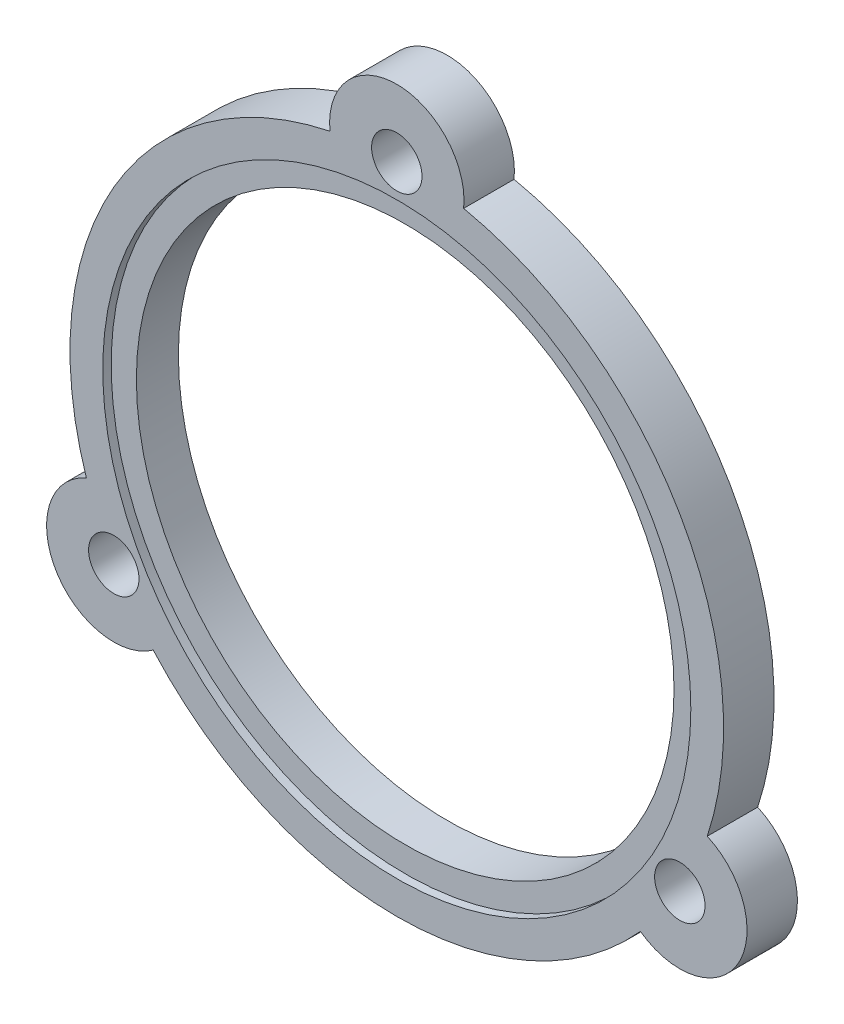
from build123d import *

# Parameters (mm, degrees)
ESQUISSE1_R                                = 19.45
ESQUISSE1_R_2                              = 16
BOSS_EXTRU_1_DEPTH                         = 3
ENL_V_MAT_EXTRU_1_DEPTH                    = 3
BOSS_EXTRU_2_DEPTH                         = 3
R_P_TITION_CIRCULAIRE1_COUNT               = 2
R_P_TITION_CIRCULAIRE1_ANGLE               = 120
R_P_TITION_CIRCULAIRE1_THE_OTHER_WAY_COUNT = 2
R_P_TITION_CIRCULAIRE1_THE_OTHER_WAY_ANGLE = 120
ESQUISSE2_R                                = 17.5
ENL_V_MAT_EXTRU_2_DEPTH                    = 0.5


with BuildPart() as part:
    # Esquisse1 → Boss.-Extru.1 (new body)
    with BuildSketch(Plane.XY):
        Circle(ESQUISSE1_R)
        Circle(ESQUISSE1_R_2, mode=Mode.SUBTRACT)
    extrude(amount=BOSS_EXTRU_1_DEPTH)

    # Esquisse1<12> → Enlèv. mat.-Extru.1 (cut)
    with BuildSketch(Plane.XY):
        with BuildLine():
            ThreePointArc((-1.498884406, 19.392159383), (-1.040009393, 18.369083508), (0, 17.95))
            Line((0, 17.95), (0, 19.45))
            ThreePointArc((0, 19.45), (-0.75, 19.435534467), (-1.498884406, 19.392159383))
        make_face()
        with BuildLine():
            Line((0, 19.45), (0, 17.95))
            ThreePointArc((0, 17.95), (1.040009393, 18.369083508), (1.498884406, 19.392159383))
            ThreePointArc((1.498884406, 19.392159383), (0.75, 19.435534467), (0, 19.45))
        make_face()
    enl_v_mat_extru_1 = extrude(amount=ENL_V_MAT_EXTRU_1_DEPTH, mode=Mode.SUBTRACT)

    # Esquisse1<13> → Boss.-Extru.2 (add)
    with BuildSketch(Plane.XY):
        with BuildLine():
            ThreePointArc((-1.498884406, 19.392159383), (-0.028925687, 20.949721076), (1.5, 19.45))
            ThreePointArc((1.5, 19.45), (1.499721076, 19.421074313), (1.498884406, 19.392159383))
            ThreePointArc((1.498884406, 19.392159383), (2.744536924, 19.255389299), (3.978796705, 19.038688946))
            ThreePointArc((3.978796705, 19.038688946), (3.994695659, 19.244071394), (4, 19.45))
            ThreePointArc((4, 19.45), (-0.205928606, 23.444695659), (-3.978796705, 19.038688946))
            ThreePointArc((-3.978796705, 19.038688946), (-2.744536924, 19.255389299), (-1.498884406, 19.392159383))
        make_face()
    boss_extru_2 = extrude(amount=BOSS_EXTRU_2_DEPTH)

    # Répétition circulaire1: Enlèv. mat.-Extru.1, Boss.-Extru.2 ×2 about axis
    r_p_tition_circulaire1_axis = Axis((0, 0, 3), (0, 0, -1))
    add([enl_v_mat_extru_1.rotate(r_p_tition_circulaire1_axis, i * R_P_TITION_CIRCULAIRE1_ANGLE / (R_P_TITION_CIRCULAIRE1_COUNT - 1)) for i in range(1, R_P_TITION_CIRCULAIRE1_COUNT)], mode=Mode.SUBTRACT)
    add([boss_extru_2.rotate(r_p_tition_circulaire1_axis, i * R_P_TITION_CIRCULAIRE1_ANGLE / (R_P_TITION_CIRCULAIRE1_COUNT - 1)) for i in range(1, R_P_TITION_CIRCULAIRE1_COUNT)])

    # Répétition circulaire1 the other way: Enlèv. mat.-Extru.1, Boss.-Extru.2 ×2 about axis
    r_p_tition_circulaire1_the_other_way_axis = Axis((0, 0, 3), (0, 0, 1))
    add([enl_v_mat_extru_1.rotate(r_p_tition_circulaire1_the_other_way_axis, i * R_P_TITION_CIRCULAIRE1_THE_OTHER_WAY_ANGLE / (R_P_TITION_CIRCULAIRE1_THE_OTHER_WAY_COUNT - 1)) for i in range(1, R_P_TITION_CIRCULAIRE1_THE_OTHER_WAY_COUNT)], mode=Mode.SUBTRACT)
    add([boss_extru_2.rotate(r_p_tition_circulaire1_the_other_way_axis, i * R_P_TITION_CIRCULAIRE1_THE_OTHER_WAY_ANGLE / (R_P_TITION_CIRCULAIRE1_THE_OTHER_WAY_COUNT - 1)) for i in range(1, R_P_TITION_CIRCULAIRE1_THE_OTHER_WAY_COUNT)])

    # Esquisse2 → Enlèv. mat.-Extru.2 (cut)
    with BuildSketch(Plane.XY.offset(3)):
        Circle(ESQUISSE2_R)
    extrude(amount=-ENL_V_MAT_EXTRU_2_DEPTH, mode=Mode.SUBTRACT)


solid = part.part
